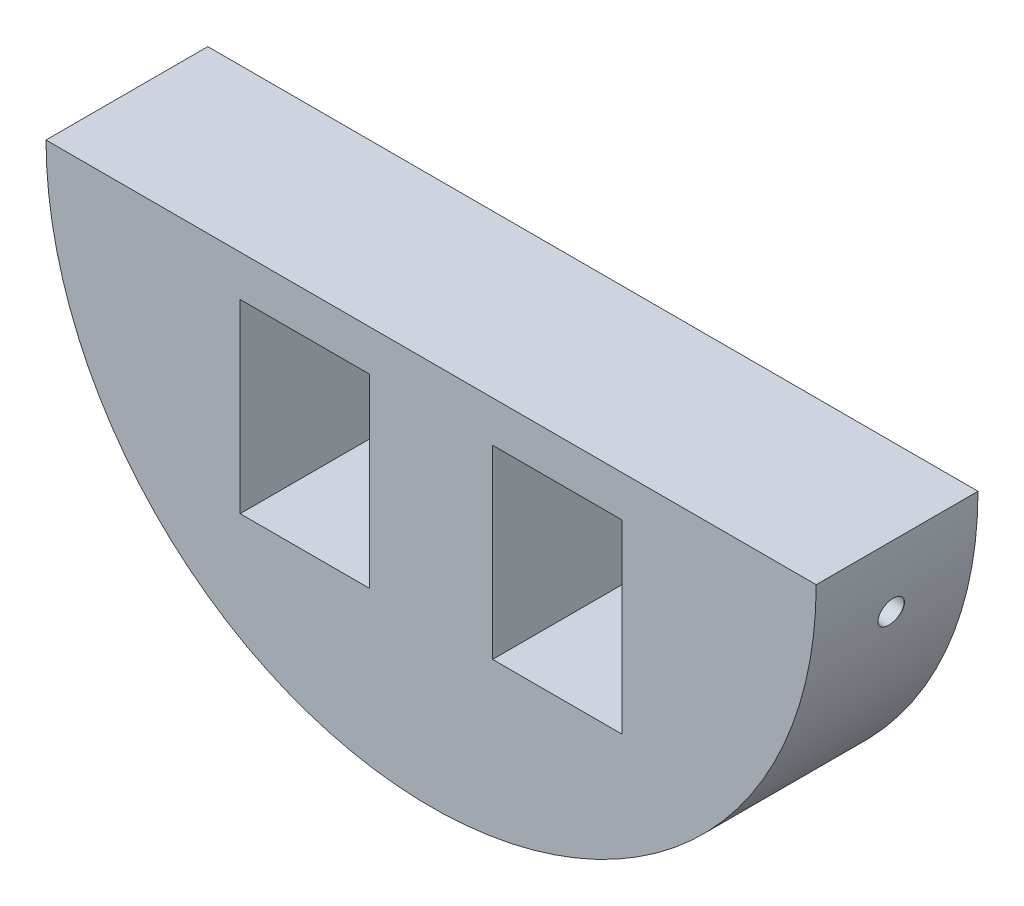
from build123d import *
from OCP.BRepFilletAPI import BRepFilletAPI_MakeChamfer

# Parameters (mm, degrees)
SKETCH1_W           = 20
SKETCH1_H           = 20
BOSS_EXTRUDE1_DEPTH = 25
CIRPATTERN1_COUNT   = 5
CIRPATTERN1_ANGLE   = 160
CHAMFER1_SIZE       = 15
CHAMFER1_SIZE2      = 8.660254038


with BuildPart() as part:
    # Sketch1 → Boss-Extrude1 (new body)
    with BuildSketch(Plane.XY):
        with BuildLine():
            Line((-119, 0), (0, 0))
            ThreePointArc((0, 0), (-59.5, -59.5), (-119, 0))
        make_face()
        with Locations((-40, -25)):
            Rectangle(SKETCH1_W, SKETCH1_H, mode=Mode.SUBTRACT)
        with Locations((-79, -25)):
            Rectangle(SKETCH1_W, SKETCH1_H, mode=Mode.SUBTRACT)
    extrude(amount=BOSS_EXTRUDE1_DEPTH)

    # Sketch4 → Ø4.0mm Dowel Hole2 (revolve, cut)
    with BuildSketch(Plane(origin=(-0.903938696, -10.332066571, 12.5), x_dir=(0.1736481776669305, 0.9848077530122081, 0), z_dir=(0, 0, 1))):
        Polygon((0, 0), (0, 11.201721238), (2, 10), (2, 0.025), (2.025, 0), align=None)
    f_4_0mm_dowel_hole2 = revolve(axis=Axis((5.349590536, -11.434732499, 12.5), (-0.9848077530122081, 0.1736481776669305, 0)), mode=Mode.SUBTRACT)

    # CirPattern1: Ø4.0mm Dowel Hole2 ×5 about axis
    cirpattern1_axis = Axis((-59.5, 0, 0), (0, 0, -1))
    for i in range(1, CIRPATTERN1_COUNT):
        add(f_4_0mm_dowel_hole2.rotate(cirpattern1_axis, i * CIRPATTERN1_ANGLE / (CIRPATTERN1_COUNT - 1)), mode=Mode.SUBTRACT)

    # Chamfer1: one chamfer whose edges measure the first distance from different faces: ONE call of the kernel's chamfer builder (chamfer() names one face for all edges)
    chamfer1_edges_1 = [part.edges().sort_by_distance(p)[0] for p in [
        (-40, -15, 25),
    ]]
    chamfer1_side_1 = [part.faces().sort_by_distance(p)[0] for p in [
        (-40, -15, 12.5),
    ]]
    chamfer1_edges_2 = [part.edges().sort_by_distance(p)[0] for p in [
        (-79, -15, 25),
    ]]
    chamfer1_side_2 = [part.faces().sort_by_distance(p)[0] for p in [
        (-79, -15, 12.5),
    ]]
    chamfer1 = BRepFilletAPI_MakeChamfer(part.part.solid().wrapped)
    for e in chamfer1_edges_1:
        chamfer1.Add(CHAMFER1_SIZE, CHAMFER1_SIZE2, e.wrapped, chamfer1_side_1[0].wrapped)  # the first distance lies on this face
    for e in chamfer1_edges_2:
        chamfer1.Add(CHAMFER1_SIZE, CHAMFER1_SIZE2, e.wrapped, chamfer1_side_2[0].wrapped)  # the first distance lies on this face
    add(Compound.cast(chamfer1.Shape()), mode=Mode.REPLACE)


solid = part.part
